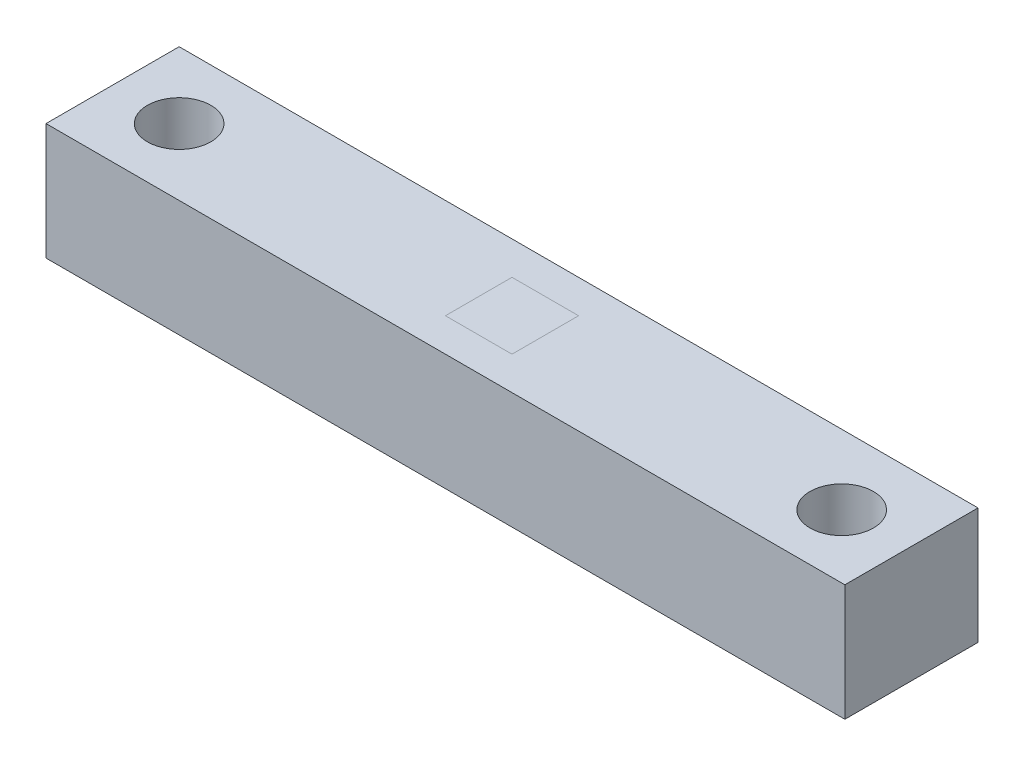
from build123d import *

# Parameters (mm, degrees)
SKETCH1_W           = 240
SKETCH1_H           = 35
BOSS_EXTRUDE1_DEPTH = 40
SKETCH3_R           = 9.525
CUT_EXTRUDE4_DEPTH  = 132.244047484


with BuildPart() as part:
    # Sketch1 → Boss-Extrude1 (new body)
    with BuildSketch(Plane.XY):
        Rectangle(SKETCH1_W, SKETCH1_H)
    extrude(amount=BOSS_EXTRUDE1_DEPTH)

    # Sketch3 → Cut-Extrude4 (cut, through all)
    with BuildSketch(Plane(origin=(0, 17.5, 0), x_dir=(1, 0, 0), z_dir=(0, 1, 0))):
        with Locations(Location((-100, -20, 0), (0, 0, 180))):
            Circle(SKETCH3_R)
        with Locations(Location((100, -20.95, 0), (0, 0, 180))):
            Circle(SKETCH3_R)
    extrude(amount=-CUT_EXTRUDE4_DEPTH, mode=Mode.SUBTRACT)


solid = part.part
